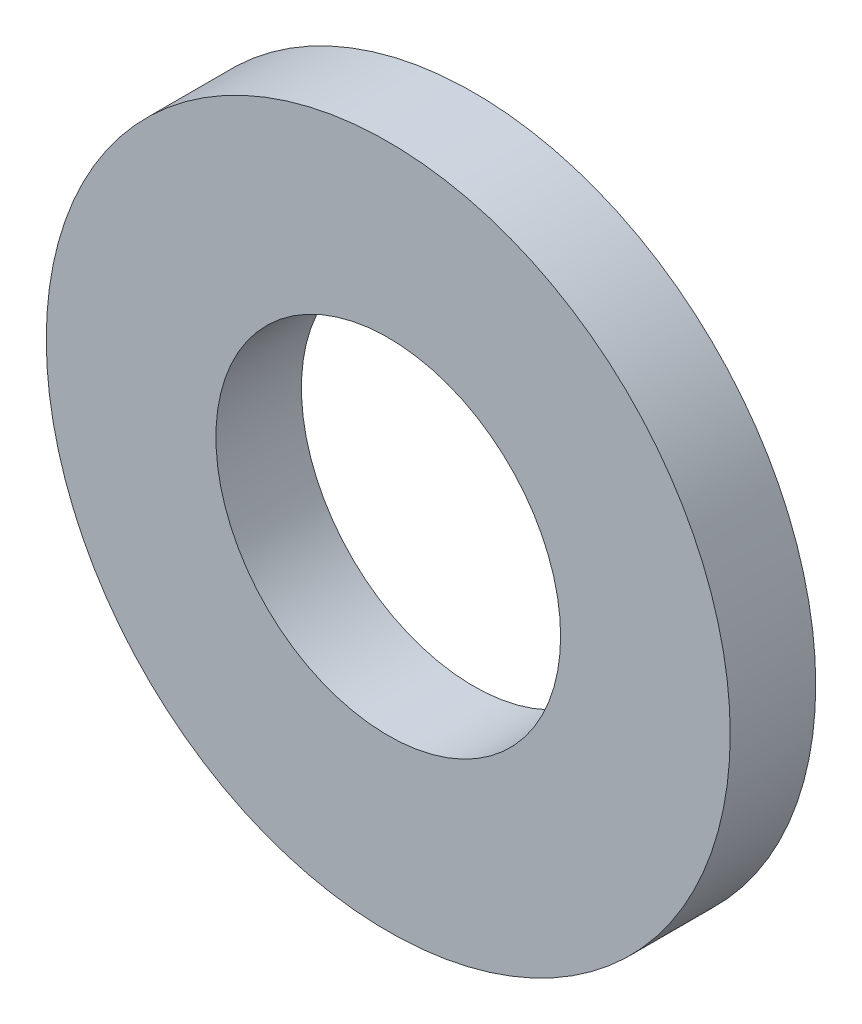
from build123d import *

# Parameters (mm, degrees)
SKETCH1_R      = 6.35
SKETCH1_R_2    = 3.2004
EXTRUDE1_DEPTH = 0.79375


with BuildPart() as part:
    # Sketch1 → Extrude1 (new, symmetric)
    with BuildSketch(Plane.XY):
        Circle(SKETCH1_R)
        Circle(SKETCH1_R_2, mode=Mode.SUBTRACT)
    extrude(amount=EXTRUDE1_DEPTH, both=True)


solid = part.part
